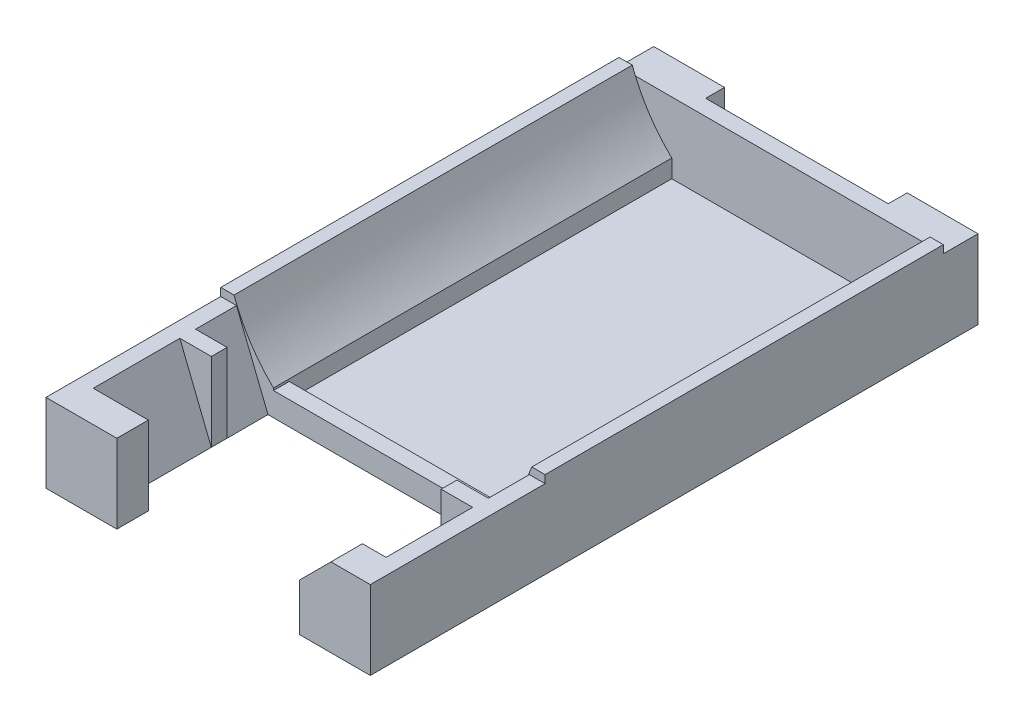
from build123d import *

# Parameters (mm, degrees)
SKETCH1_W           = 20.6
SKETCH1_H           = 17.2
BOSS_EXTRUDE1_DEPTH = 2.5
SKETCH2_W           = 20.6
SKETCH2_H           = 1.5
BOSS_EXTRUDE2_DEPTH = 25.3
SKETCH3_W           = 20.6
SKETCH3_H           = 5
BOSS_EXTRUDE3_DEPTH = 1
SKETCH4_W           = 3.35
SKETCH4_H           = 25.3
BOSS_EXTRUDE4_DEPTH = 4
CUT_EXTRUDE2_START  = 25.3
CUT_EXTRUDE2_DEPTH  = 25.3
CHAMFER1_SIZE       = 2
BOSS_EXTRUDE5_DEPTH = 1.2
SKETCH7_W           = 4.5
SKETCH7_H           = 5
BOSS_EXTRUDE6_DEPTH = 1.5
SKETCH8_R           = 16.793205084
CUT_EXTRUDE3_DEPTH  = 2.5
BOSS_EXTRUDE7_DEPTH = 11.1
BOSS_EXTRUDE8_DEPTH = 1
SKETCH11_W          = 4.5
SKETCH11_H          = 5
BOSS_EXTRUDE9_DEPTH = 2
CHAMFER2_SIZE       = 2
SKETCH12_W          = 13.9
SKETCH12_H          = 24.3
CUT_EXTRUDE4_DEPTH  = 1


with BuildPart() as part:
    # Sketch1 → Boss-Extrude1 (new body)
    with BuildSketch(Plane.XY):
        Rectangle(SKETCH1_W, SKETCH1_H)
        with BuildLine():
            Line((3.1, 2.3), (3.1, -2))
            ThreePointArc((3.1, -2), (0, -5.1), (-3.1, -2))
            Line((-3.1, -2), (-3.1, 2.3))
            ThreePointArc((-3.1, 2.3), (0, 5.4), (3.1, 2.3))
        make_face(mode=Mode.SUBTRACT)
    extrude(amount=BOSS_EXTRUDE1_DEPTH)

    # Sketch2 → Boss-Extrude2 (add)
    with BuildSketch(Plane(origin=(0, 0, 0), x_dir=(-1, 0, 0), z_dir=(0, 0, -1))):
        with Locations((0, -7.85)):
            Rectangle(SKETCH2_W, SKETCH2_H)
    extrude(amount=BOSS_EXTRUDE2_DEPTH)

    # Sketch3 → Boss-Extrude3 (add)
    with BuildSketch(Plane(origin=(0, 0, -25.3), x_dir=(-1, 0, 0), z_dir=(0, 0, -1))):
        with Locations((0, -6.1)):
            Rectangle(SKETCH3_W, SKETCH3_H)
    extrude(amount=BOSS_EXTRUDE3_DEPTH)

    # Sketch4 → Boss-Extrude4 (add)
    with BuildSketch(Plane(origin=(0, -7.1, 0), x_dir=(1, 0, 0), z_dir=(0, 1, 0))):
        with Locations((-8.625, 12.65)):
            Rectangle(SKETCH4_W, SKETCH4_H)
        with Locations((8.625, 12.65)):
            Rectangle(SKETCH4_W, SKETCH4_H)
    extrude(amount=BOSS_EXTRUDE4_DEPTH)

    # Sketch5 → Cut-Extrude2 (cut)
    # profile 1 of 3: a face of its own
    with BuildSketch(Plane(origin=(0, 0, 0), x_dir=(-1, 0, 0), z_dir=(0, 0, -1)).offset(CUT_EXTRUDE2_START)):
        with BuildLine():
            Line((-6.800183821, -7.1), (6.800183821, -7.1))
            ThreePointArc((6.800183821, -7.1), (6.87545093, -7.030121044), (6.95, -6.959476565))
            Line((6.95, -6.959476565), (6.95, -3.1))
            Line((6.95, -3.1), (9.457404507, -3.1))
            ThreePointArc((9.457404507, -3.1), (9.900742783, -1.425628104), (10.05, 0.3))
            ThreePointArc((10.05, 0.3), (8.886892922, 4.993147579), (5.666789214, 8.6))
            Line((5.666789214, 8.6), (-5.666789214, 8.6))
            ThreePointArc((-5.666789214, 8.6), (-9.560743116, 3.397529834), (-9.457404507, -3.1))
            Line((-9.457404507, -3.1), (-6.95, -3.1))
            Line((-6.95, -3.1), (-6.95, -6.959476565))
            ThreePointArc((-6.95, -6.959476565), (-6.87545093, -7.030121044), (-6.800183821, -7.1))
        make_face()
        with BuildLine():
            ThreePointArc((3.1, -2), (0, -5.1), (-3.1, -2))
            Line((-3.1, -2), (-3.1, 2.3))
            ThreePointArc((-3.1, 2.3), (0, 5.4), (3.1, 2.3))
            Line((3.1, 2.3), (3.1, -2))
        make_face(mode=Mode.SUBTRACT)
    # profile 2 of 3: a face of its own
    with BuildSketch(Plane(origin=(0, 0, 0), x_dir=(-1, 0, 0), z_dir=(0, 0, -1)).offset(CUT_EXTRUDE2_START)):
        with BuildLine():
            Line((6.95, -3.1), (6.95, -6.959476565))
            ThreePointArc((6.95, -6.959476565), (8.427610604, -5.175205887), (9.457404507, -3.1))
            Line((9.457404507, -3.1), (6.95, -3.1))
        make_face()
    # profile 3 of 3: a face of its own
    with BuildSketch(Plane(origin=(0, 0, 0), x_dir=(-1, 0, 0), z_dir=(0, 0, -1)).offset(CUT_EXTRUDE2_START)):
        with BuildLine():
            ThreePointArc((-9.457404507, -3.1), (-8.427610604, -5.175205887), (-6.95, -6.959476565))
            Line((-6.95, -6.959476565), (-6.95, -3.1))
            Line((-6.95, -3.1), (-9.457404507, -3.1))
        make_face()
    extrude(amount=-CUT_EXTRUDE2_DEPTH, mode=Mode.SUBTRACT)

    # Chamfer1
    chamfer1_edges = [part.edges().sort_by_distance(p)[0] for p in [
        (-10.3, 8.6, 1.25),
        (10.3, 8.6, 1.25),
    ]]
    chamfer(chamfer1_edges, length=CHAMFER1_SIZE)

    # Sketch6 → Boss-Extrude5 (add)
    with BuildSketch(Plane(origin=(0, 0, -26.3), x_dir=(-1, 0, 0), z_dir=(0, 0, -1))):
        Polygon((-7.3, -8.6), (-10.3, -8.6), (-10.3, -3.6), (-9.3, -3.6), align=None)
        Polygon((9.3, -3.6), (7.3, -8.6), (10.3, -8.6), (10.3, -3.6), align=None)
    extrude(amount=BOSS_EXTRUDE5_DEPTH)

    # Sketch7 → Boss-Extrude6 (add)
    with BuildSketch(Plane(origin=(0, 0, -27.5), x_dir=(-1, 0, 0), z_dir=(0, 0, -1))):
        with Locations((-8.05, -6.1)):
            Rectangle(SKETCH7_W, SKETCH7_H)
        with Locations((8.05, -6.1)):
            Rectangle(SKETCH7_W, SKETCH7_H)
    extrude(amount=-BOSS_EXTRUDE6_DEPTH)

    # Sketch8 → Cut-Extrude3 (cut)
    with BuildSketch(Plane.XY.offset(2.5)):
        Circle(SKETCH8_R)
    extrude(amount=-CUT_EXTRUDE3_DEPTH, mode=Mode.SUBTRACT)

    # Sketch9 → Boss-Extrude7 (add)
    with BuildSketch(Plane.XY):
        Polygon((7.3, -8.6), (10.3, -8.6), (10.3, -3.6), (9.3, -3.6), align=None)
        Polygon((-10.3, -8.6), (-7.3, -8.6), (-9.3, -3.6), (-10.3, -3.6), align=None)
    extrude(amount=BOSS_EXTRUDE7_DEPTH)

    # Sketch10 → Boss-Extrude8 (add)
    with BuildSketch(Plane.XY.offset(2.6)):
        Polygon((-9.3, -3.6), (-7.3, -3.6), (-7.3, -8.6), (-10.3, -8.6), (-10.3, -3.6), align=None)
        Polygon((9.3, -3.6), (7.3, -3.6), (7.3, -8.6), (10.3, -8.6), (10.3, -3.6), align=None)
    extrude(amount=BOSS_EXTRUDE8_DEPTH)

    # Sketch11 → Boss-Extrude9 (add)
    with BuildSketch(Plane.XY.offset(11.1)):
        with Locations((-8.05, -6.1)):
            Rectangle(SKETCH11_W, SKETCH11_H)
        with Locations((8.05, -6.1)):
            Rectangle(SKETCH11_W, SKETCH11_H)
    extrude(amount=-BOSS_EXTRUDE9_DEPTH)

    # Chamfer2
    chamfer2_edges = [part.edges().sort_by_distance(p)[0] for p in [
        (5.8, -3.6, 10.1),
    ]]
    chamfer(chamfer2_edges, length=CHAMFER2_SIZE)

    # Sketch12 → Cut-Extrude4 (cut)
    with BuildSketch(Plane(origin=(0, -7.1, 0), x_dir=(1, 0, 0), z_dir=(0, 1, 0))):
        with Locations((0, 13.15)):
            Rectangle(SKETCH12_W, SKETCH12_H)
    extrude(amount=-CUT_EXTRUDE4_DEPTH, mode=Mode.SUBTRACT)


solid = part.part
